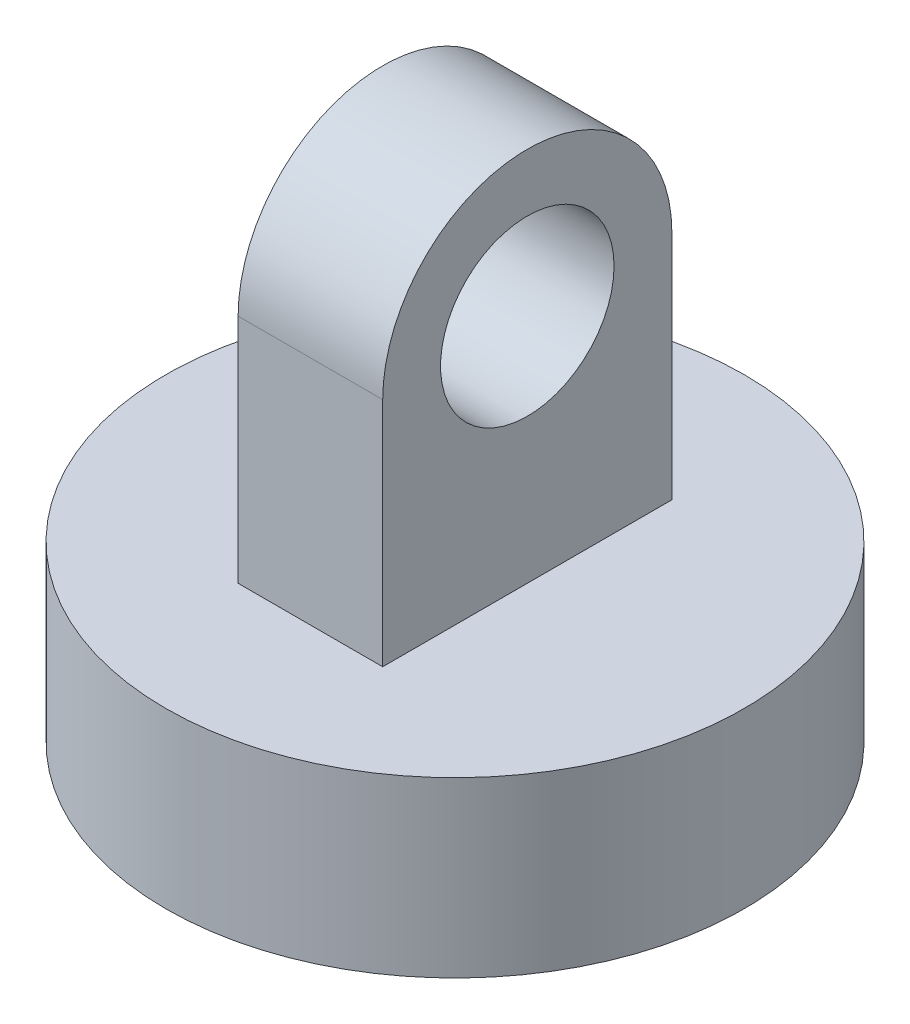
from build123d import *

# Parameters (mm, degrees)
SKETCH1_R           = 50
BOSS_EXTRUDE1_DEPTH = 30
SKETCH2_R           = 15
BOSS_EXTRUDE2_DEPTH = 12.5


with BuildPart() as part:
    # Sketch1 → Boss-Extrude1 (new body)
    with BuildSketch(Plane(origin=(0, 0, 0), x_dir=(1, 0, 0), z_dir=(0, 1, 0))):
        with Locations(Location((0, 0, 0), (0, 0, 270))):
            Circle(SKETCH1_R)
    extrude(amount=BOSS_EXTRUDE1_DEPTH)

    # Sketch2 → Boss-Extrude2 (add, symmetric)
    with BuildSketch(Plane(origin=(0, 0, 0), x_dir=(0, 0, -1), z_dir=(1, 0, 0))):
        with BuildLine():
            Line((-25, 70), (-25, 30))
            Line((-25, 30), (25, 30))
            Line((25, 30), (25, 70))
            ThreePointArc((25, 70), (0, 95), (-25, 70))
        make_face()
        with Locations((0, 70)):
            Circle(SKETCH2_R, mode=Mode.SUBTRACT)
    extrude(amount=BOSS_EXTRUDE2_DEPTH, both=True)


solid = part.part
